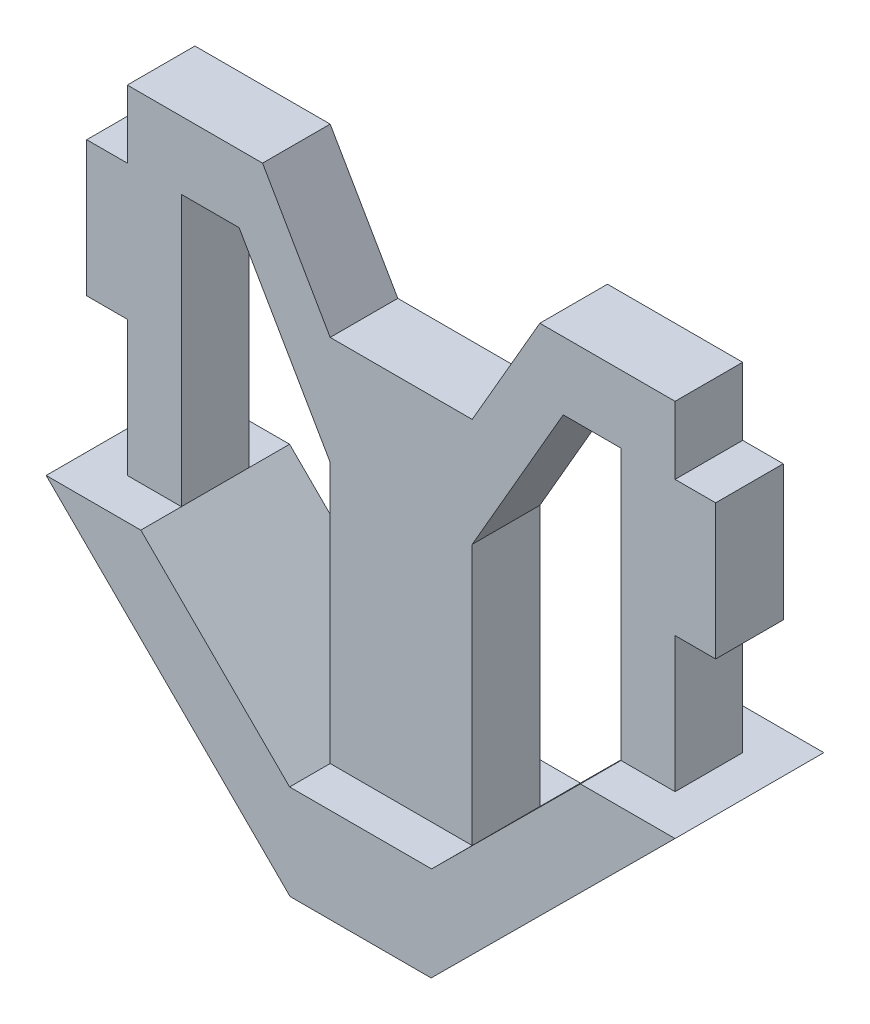
from build123d import *

# Parameters (mm, degrees)
EXTRUDE_1_DEPTH = 2.5
EXTRUDE_2_DEPTH = 5.5


with BuildPart() as part:
    # 草图1 → 凸台-拉伸1 (new, symmetric)
    with BuildSketch(Plane.XY):
        Polygon((-5.251410484, 27.285955328), (5.251410484, 27.285955328), (10.251410484, 35.946209366), (20.251410484, 35.946209366), (20.251410484, 30.946209366), (23.251410484, 30.946209366), (23.251410484, 20.946209366), (20.251410484, 20.946209366), (20.251410484, 10.946209366), (16.251410484, 10.946209366), (16.251410484, 30.946209366), (11.983461292, 30.946209366), (5.251410484, 19.285955328), (5.251410484, 0), (0, 0), (-5.251410484, 0), (-5.251410484, 19.285955328), (-11.983461292, 30.946209366), (-16.251410484, 30.946209366), (-16.251410484, 10.946209366), (-20.251410484, 10.946209366), (-20.251410484, 20.946209366), (-23.251410484, 20.946209366), (-23.251410484, 30.946209366), (-20.251410484, 30.946209366), (-20.251410484, 35.946209366), (-10.251410484, 35.946209366), align=None)
    extrude(amount=EXTRUDE_1_DEPTH, both=True)

    # 草图2 → 凸台-拉伸2 (add, symmetric)
    with BuildSketch(Plane.XY):
        Polygon((16.251410484, 10.946209366), (23.251410484, 10.946209366), (5.21701187, -7), (0, -7), (-5.21701187, -7), (-23.251410484, 10.946209366), (-16.251410484, 10.946209366), (-5.251410484, 0), (0, 0), (5.251410484, 0), align=None)
    extrude(amount=EXTRUDE_2_DEPTH, both=True)


solid = part.part
